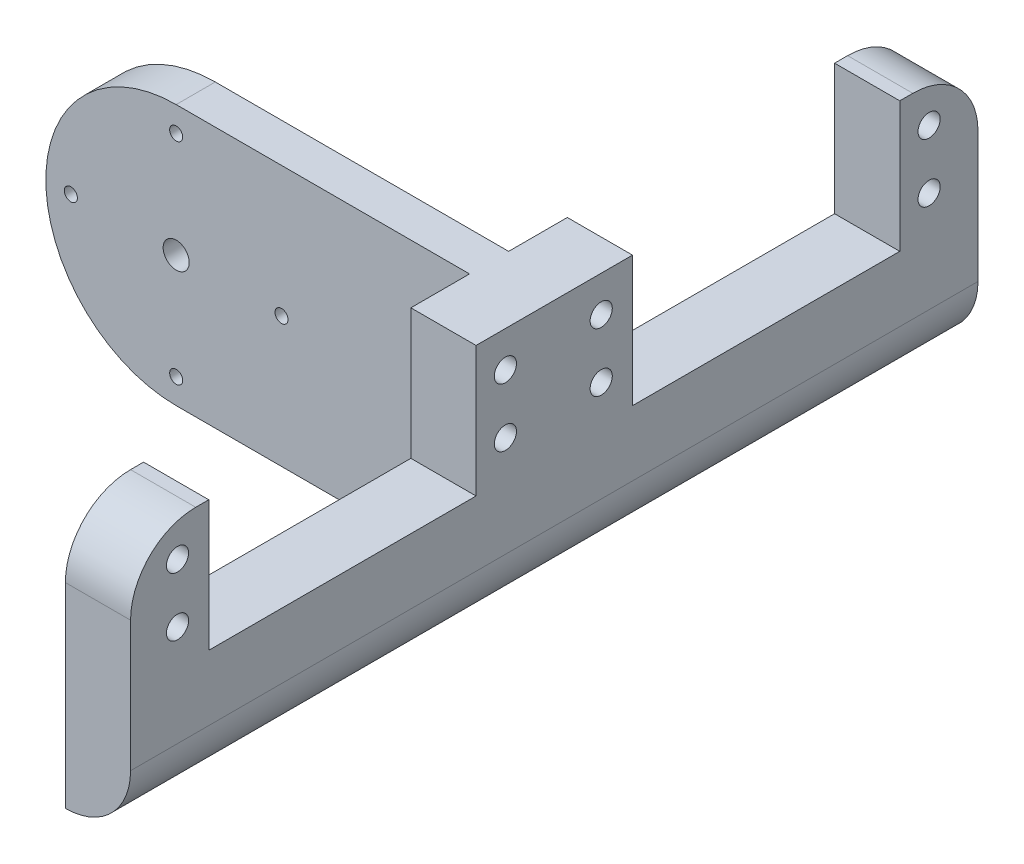
from build123d import *

# Parameters (mm, degrees)
EXTRUDE_1_DEPTH      = 3
EXTRUDE_1_DEPTH_BACK = 3
SKETCH_1_R           = 2
SKETCH_1_R_2         = 1
SKETCH_2_W           = 130
SKETCH_2_H           = 40
EXTRUDE_2_DEPTH      = 10
SKETCH_3_W           = 41
SKETCH_3_H           = 20
CUT_EXTRUDE_1_DEPTH  = 10
FILLET_1_R           = 10
HOLE_WIZARD_M3_1_D   = 3.4
FILLET_4_R           = 10


with BuildPart() as part:
    # 스케치1 → 보스-돌출1 (new, two sides: drawn at the far end of the back side and taken through both)
    with BuildSketch(Plane.XY.offset(-EXTRUDE_1_DEPTH_BACK)):
        with BuildLine():
            Line((0, 20), (45, 20))
            Line((45, 20), (45, -20))
            Line((45, -20), (0, -20))
            ThreePointArc((0, -20), (-20, 0), (0, 20))
        make_face()
        Circle(SKETCH_1_R, mode=Mode.SUBTRACT)
        with Locations((0, 16.16)):
            Circle(SKETCH_1_R_2, mode=Mode.SUBTRACT)
        with Locations((16.16, 0)):
            Circle(SKETCH_1_R_2, mode=Mode.SUBTRACT)
        with Locations((0, -16.16)):
            Circle(SKETCH_1_R_2, mode=Mode.SUBTRACT)
        with Locations((-16.16, 0)):
            Circle(SKETCH_1_R_2, mode=Mode.SUBTRACT)
    extrude(amount=EXTRUDE_1_DEPTH + EXTRUDE_1_DEPTH_BACK)

    # 스케치2 → 보스-돌출2 (add)
    with BuildSketch(Plane(origin=(45, 0, 0), x_dir=(0, 0, -1), z_dir=(1, 0, 0))):
        Rectangle(SKETCH_2_W, SKETCH_2_H)
    extrude(amount=EXTRUDE_2_DEPTH)

    # 스케치3 → 컷-돌출1 (cut)
    with BuildSketch(Plane(origin=(55, 0, 0), x_dir=(0, 0, -1), z_dir=(1, 0, 0))):
        with Locations((32.5, 10)):
            Rectangle(SKETCH_3_W, SKETCH_3_H)
        with Locations((-32.5, 10)):
            Rectangle(SKETCH_3_W, SKETCH_3_H)
    extrude(amount=-CUT_EXTRUDE_1_DEPTH, mode=Mode.SUBTRACT)

    # 필렛1
    fillet_1_edges = [part.edges().sort_by_distance(p)[0] for p in [
        (55, -20, 0),
    ]]
    fillet(fillet_1_edges, radius=FILLET_1_R)

    # M3 여유 구멍1 (through all)
    with Locations(Plane(origin=(55, 0, 0), x_dir=(0, 0, -1), z_dir=(1, 0, 0))):
        with Locations((-57.8, 14.5), (-57.8, 5.5), (-7.5, 14.5), (-7.5, 5.5), (7.2, 14.5), (7.2, 5.5), (57.5, 14.5), (57.5, 5.5)):
            Hole(HOLE_WIZARD_M3_1_D / 2)

    # 필렛4
    fillet_4_edges = [part.edges().sort_by_distance(p)[0] for p in [
        (50, 20, -65),
        (50, 20, 65),
    ]]
    fillet(fillet_4_edges, radius=FILLET_4_R)


solid = part.part
